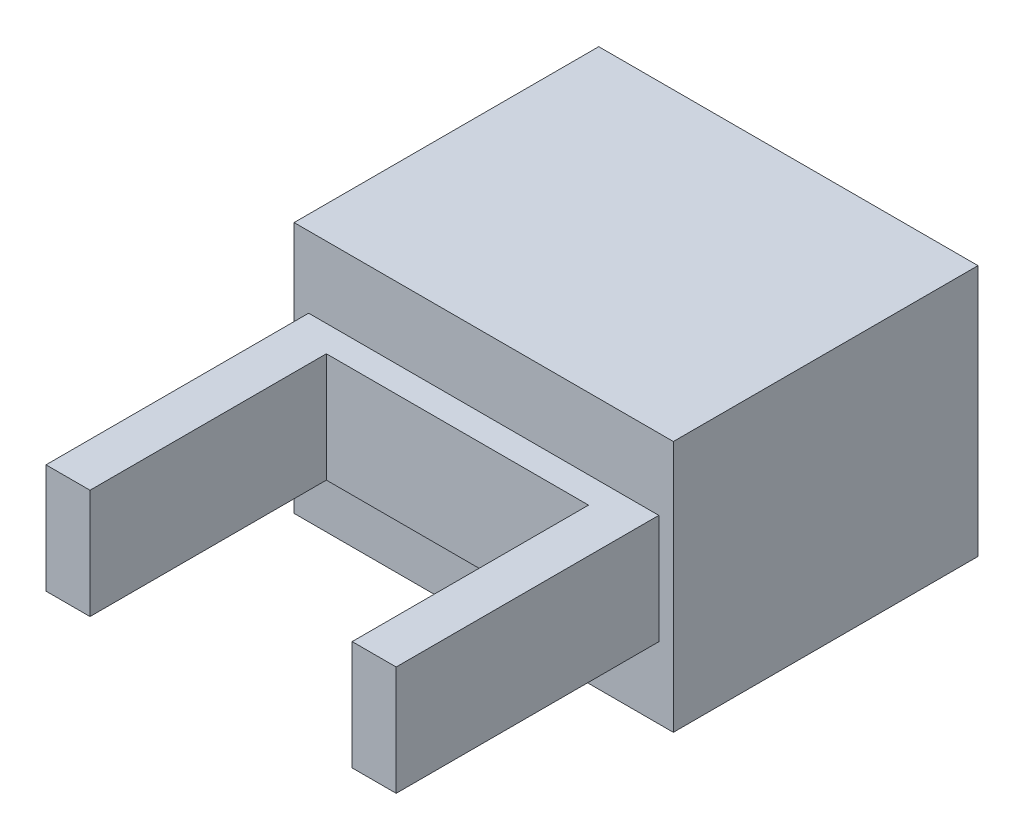
from build123d import *

# Parameters (mm, degrees)
SKETCH1_W           = 101.6
SKETCH1_H           = 31.75
BOSS_EXTRUDE1_DEPTH = 76.2
SKETCH2_W           = 76.064070538
SKETCH2_H           = 31.75
CUT_EXTRUDE1_DEPTH  = 68.58
SKETCH4_W           = 110.036041042
SKETCH4_H           = 73.081165812
BOSS_EXTRUDE2_DEPTH = 88.392


with BuildPart() as part:
    # Sketch1 → Boss-Extrude1 (new body)
    with BuildSketch(Plane.XY):
        Rectangle(SKETCH1_W, SKETCH1_H)
    extrude(amount=BOSS_EXTRUDE1_DEPTH)

    # Sketch2 → Cut-Extrude1 (cut)
    with BuildSketch(Plane.XY.offset(76.2)):
        Rectangle(SKETCH2_W, SKETCH2_H)
    extrude(amount=-CUT_EXTRUDE1_DEPTH, mode=Mode.SUBTRACT)

    # Sketch4 → Boss-Extrude2 (add)
    with BuildSketch(Plane(origin=(0, 0, 0), x_dir=(-1, 0, 0), z_dir=(0, 0, -1))):
        Rectangle(SKETCH4_W, SKETCH4_H)
    extrude(amount=BOSS_EXTRUDE2_DEPTH)


solid = part.part
